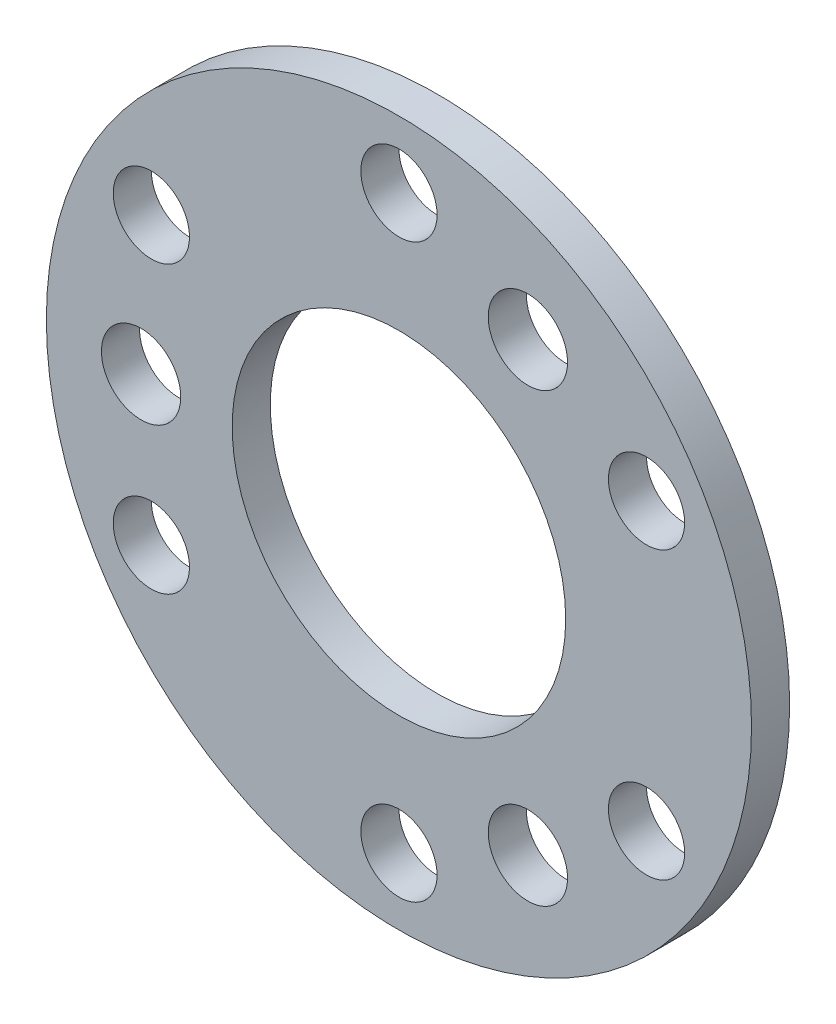
from build123d import *

# Parameters (mm, degrees)
SKETCH_1_R      = 18.5
SKETCH_1_R_2    = 2
SKETCH_1_R_3    = 2.08
SKETCH_1_R_4    = 8.75
EXTRUDE_1_DEPTH = 2


with BuildPart() as part:
    # 草图1 → 凸台-拉伸1 (new body)
    with BuildSketch(Plane.XY):
        with Locations((-0.985220571, 0.129022057)):
            Circle(SKETCH_1_R)
        with Locations((-0.985220571, -14.870977943)):
            Circle(SKETCH_1_R_2, mode=Mode.SUBTRACT)
        with Locations((-13.975601628, -7.370977943)):
            Circle(SKETCH_1_R_2, mode=Mode.SUBTRACT)
        with Locations((-13.975601628, 7.629022057)):
            Circle(SKETCH_1_R_2, mode=Mode.SUBTRACT)
        with Locations((-0.985220571, 15.129022057)):
            Circle(SKETCH_1_R_2, mode=Mode.SUBTRACT)
        with Locations((12.005160486, 7.629022057)):
            Circle(SKETCH_1_R_2, mode=Mode.SUBTRACT)
        with Locations((12.005160486, -7.370977943)):
            Circle(SKETCH_1_R_2, mode=Mode.SUBTRACT)
        with Locations((-14.515220571, 0.129022057)):
            Circle(SKETCH_1_R_3, mode=Mode.SUBTRACT)
        with Locations((5.779779429, 11.84634577)):
            Circle(SKETCH_1_R_3, mode=Mode.SUBTRACT)
        with Locations((5.779779429, -11.588301656)):
            Circle(SKETCH_1_R_3, mode=Mode.SUBTRACT)
        with Locations((-0.985220571, 0.129022057)):
            Circle(SKETCH_1_R_4, mode=Mode.SUBTRACT)
    extrude(amount=EXTRUDE_1_DEPTH)


solid = part.part
